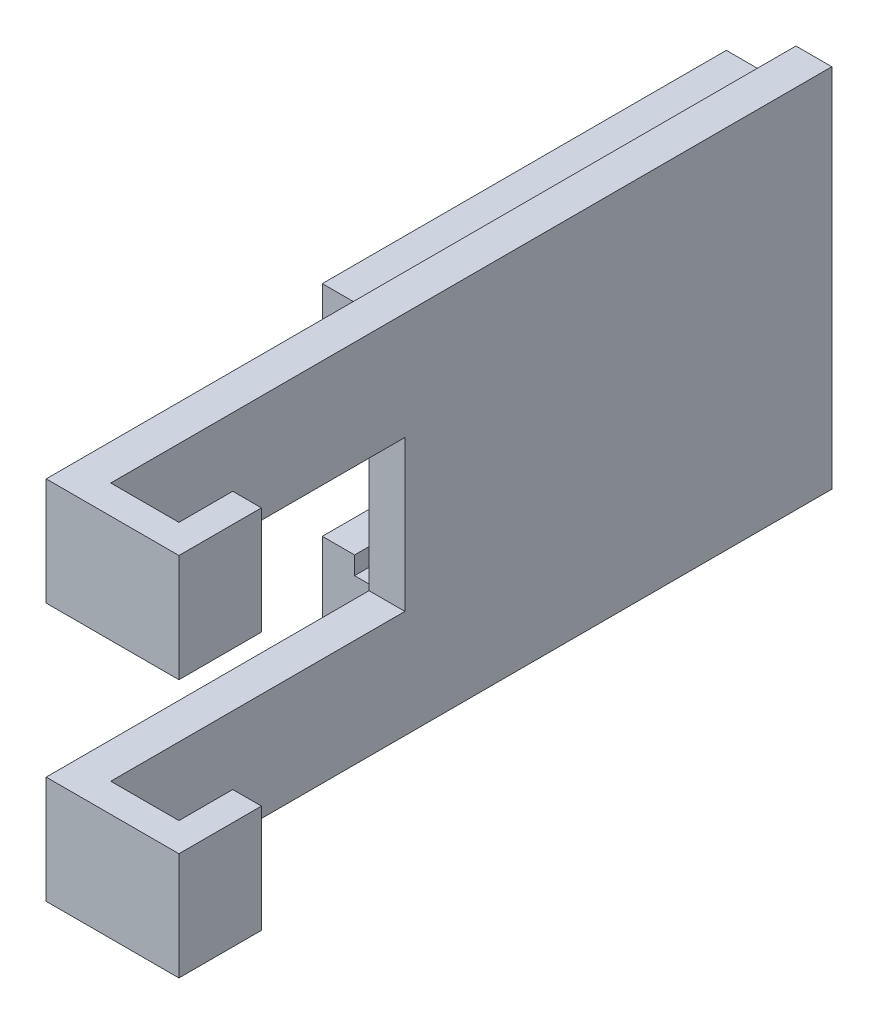
from build123d import *

# Parameters (mm, degrees)
BOSS_EXTRUDE1_DEPTH = 5
SKETCH5_W           = 4
SKETCH5_H           = 15
BOSS_EXTRUDE2_DEPTH = 13.5
SKETCH6_W           = 4
SKETCH6_H           = 15
BOSS_EXTRUDE3_DEPTH = 7.5
SKETCH7_W           = 56.316926488
SKETCH7_H           = 4.75
BOSS_EXTRUDE4_DEPTH = 5.2
SKETCH8_W           = 56.316926488
SKETCH8_H           = 9.75
BOSS_EXTRUDE5_DEPTH = 4.5


with BuildPart() as part:
    # Sketch4 → Boss-Extrude1 (new body)
    with BuildSketch(Plane(origin=(0, 0, 0), x_dir=(0, 0, -1), z_dir=(1, 0, 0))):
        Polygon((-207.602722557, -7.920601616), (-252.602722557, -7.920601616), (-252.602722557, -22.920601616), (-148.102722557, -22.920601616), (-148.102722557, 28.079398384), (-252.602722557, 28.079398384), (-252.602722557, 13.079398384), (-207.602722557, 13.079398384), align=None)
    extrude(amount=BOSS_EXTRUDE1_DEPTH)

    # Sketch5 → Boss-Extrude2 (add)
    with BuildSketch(Plane(origin=(5, 0, 0), x_dir=(0, 0, -1), z_dir=(1, 0, 0))):
        with Locations((-250.602722557, 20.579398384)):
            Rectangle(SKETCH5_W, SKETCH5_H)
        with Locations((-250.602722557, -15.420601616)):
            Rectangle(SKETCH5_W, SKETCH5_H)
    extrude(amount=BOSS_EXTRUDE2_DEPTH)

    # Sketch6 → Boss-Extrude3 (add)
    with BuildSketch(Plane(origin=(0, 0, 248.602722557), x_dir=(-1, 0, 0), z_dir=(0, 0, -1))):
        with Locations((-16.5, -15.420601616)):
            Rectangle(SKETCH6_W, SKETCH6_H)
        with Locations((-16.5, 20.579398384)):
            Rectangle(SKETCH6_W, SKETCH6_H)
    extrude(amount=BOSS_EXTRUDE3_DEPTH)

    # Sketch7 → Boss-Extrude4 (add)
    with BuildSketch(Plane.ZY):
        with Locations((176.261185801, 17.829398384)):
            Rectangle(SKETCH7_W, SKETCH7_H)
    boss_extrude4 = extrude(amount=BOSS_EXTRUDE4_DEPTH)

    # Sketch8 → Boss-Extrude5 (add)
    with BuildSketch(Plane.ZY.offset(5.2)):
        with Locations((176.261185801, 17.829398384)):
            Rectangle(SKETCH8_W, SKETCH8_H)
    boss_extrude5 = extrude(amount=BOSS_EXTRUDE5_DEPTH)

    # Mirror1: Boss-Extrude4, Boss-Extrude5 across plane
    add(boss_extrude4.mirror(Plane(origin=(0, 2.579398384, 0), x_dir=(0, 0, 1), z_dir=(0, -1, 0))))
    add(boss_extrude5.mirror(Plane(origin=(0, 2.579398384, 0), x_dir=(0, 0, 1), z_dir=(0, -1, 0))))


solid = part.part
